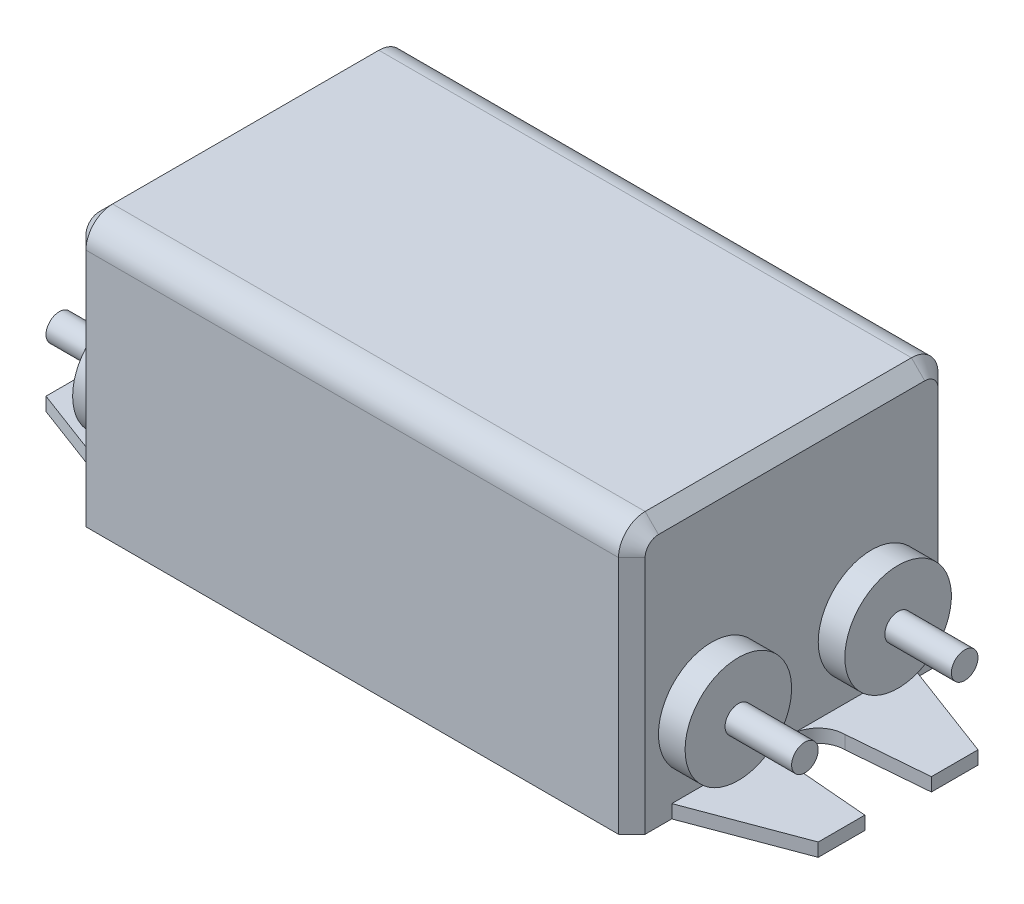
from build123d import *

# Parameters (mm, degrees)
SKETCH_1_W               = 40
SKETCH_1_H               = 24
EXTRUDE_1_DEPTH          = 20
EXTRUDE_2_DEPTH          = 1
EXTRUDE_2_2_DEPTH        = 1
EXTRUDE_2_3_DEPTH        = 1
EXTRUDE_2_4_DEPTH        = 1
SKETCH_1_6_W             = 1
SKETCH_1_6_H             = 24
EXTRUDE_4_DEPTH          = 20
SKETCH_2_R               = 4
EXTRUDE_5_DEPTH          = 2
FILLET_1_R               = 2
CHAMFER_1_SIZE           = 1
CHAMFER_2_SIZE           = 1
SKETCH_3_R               = 1
EXTRUDE_6_DEPTH          = 5
MIRROR_4_COPY_1_SKETCH_R = 1
MIRROR_4_COPY_1_DEPTH    = 5
MIRROR_4_COPY_2_SKETCH_R = 1
MIRROR_4_COPY_2_DEPTH    = 5


with BuildPart() as part:
    # 草图1 → 凸台-拉伸1 (new body)
    with BuildSketch(Plane(origin=(0, 0, 0), x_dir=(1, 0, 0), z_dir=(0, 1, 0))):
        Rectangle(SKETCH_1_W, SKETCH_1_H)
    extrude(amount=EXTRUDE_1_DEPTH)



with BuildPart() as body_2:
    # 草图1<4> → 凸台-拉伸2 (new body)
    with BuildSketch(Plane(origin=(0, 0, 0), x_dir=(1, 0, 0), z_dir=(0, 1, 0))):
        with BuildLine():
            Line((-21, 0), (-21, 9))
            Line((-21, 9), (-29, 6))
            Line((-29, 6), (-29, 2.5))
            Line((-29, 2.5), (-23, 2))
            ThreePointArc((-23, 2), (-21.585786438, 1.414213562), (-21, 0))
        make_face()
    extrude(amount=EXTRUDE_2_DEPTH)


with BuildPart() as body_3:
    # 草图1<4> → Extrude 2 2 (new body)
    with BuildSketch(Plane(origin=(0, 0, 0), x_dir=(1, 0, 0), z_dir=(0, 1, 0))):
        with BuildLine():
            Line((29, 6), (21, 9))
            Line((21, 9), (21, 0))
            ThreePointArc((21, 0), (21.585786438, 1.414213562), (23, 2))
            Line((23, 2), (29, 2.5))
            Line((29, 2.5), (29, 6))
        make_face()
    extrude(amount=EXTRUDE_2_2_DEPTH)


with BuildPart() as body_4:
    # 草图1<4> → Extrude 2 3 (new body)
    with BuildSketch(Plane(origin=(0, 0, 0), x_dir=(1, 0, 0), z_dir=(0, 1, 0))):
        with BuildLine():
            Line((-29, -6), (-21, -9))
            Line((-21, -9), (-21, 0))
            ThreePointArc((-21, 0), (-21.585786438, -1.414213562), (-23, -2))
            Line((-23, -2), (-29, -2.5))
            Line((-29, -2.5), (-29, -6))
        make_face()
    extrude(amount=EXTRUDE_2_3_DEPTH)


with BuildPart() as body_5:
    # 草图1<4> → Extrude 2 4 (new body)
    with BuildSketch(Plane(origin=(0, 0, 0), x_dir=(1, 0, 0), z_dir=(0, 1, 0))):
        with BuildLine():
            Line((21, 0), (21, -9))
            Line((21, -9), (29, -6))
            Line((29, -6), (29, -2.5))
            Line((29, -2.5), (23, -2))
            ThreePointArc((23, -2), (21.585786438, -1.414213562), (21, 0))
        make_face()
    extrude(amount=EXTRUDE_2_4_DEPTH)


with BuildPart() as part_1:
    add(part.part)

    add(body_2.part)  # 凸台-拉伸4 merges body 2

    add(body_3.part)  # 凸台-拉伸4 merges body 3

    add(body_4.part)  # 凸台-拉伸4 merges body 4

    add(body_5.part)  # 凸台-拉伸4 merges body 5
    # 草图1<6> → 凸台-拉伸4 (add)
    with BuildSketch(Plane(origin=(0, 0, 0), x_dir=(1, 0, 0), z_dir=(0, 1, 0))):
        with Locations((-20.5, 0)):
            Rectangle(SKETCH_1_6_W, SKETCH_1_6_H)
        with Locations((20.5, 0)):
            Rectangle(SKETCH_1_6_W, SKETCH_1_6_H)
    extrude(amount=EXTRUDE_4_DEPTH)

    # 草图2 → 凸台-拉伸5 (add)
    with BuildSketch(Plane.ZY.offset(21)):
        with Locations((6, 6)):
            Circle(SKETCH_2_R)
        with Locations((-6, 6)):
            Circle(SKETCH_2_R)
    extrude_5 = extrude(amount=EXTRUDE_5_DEPTH)

    # 镜向1: 凸台-拉伸5 across plane
    add(extrude_5.mirror(Plane(origin=(0, 0, 0), x_dir=(0, 0, 1), z_dir=(1, 0, 0))))

    # 圆角1
    fillet_1_edges = [part_1.edges().sort_by_distance(p)[0] for p in [
        (0, 20, -12),
        (0, 20, 12),
    ]]
    fillet(fillet_1_edges, radius=FILLET_1_R)

    # 倒角1
    chamfer_1_edges = [part_1.edges().sort_by_distance(p)[0] for p in [
        (21, 9, -12),
        (21, 9, 12),
        (21, 19.414213562, -11.414213562),
        (21, 19.414213562, 11.414213562),
        (21, 20, 0),
    ]]
    chamfer(chamfer_1_edges, length=CHAMFER_1_SIZE)

    # 倒角2
    chamfer_2_edges = [part_1.edges().sort_by_distance(p)[0] for p in [
        (-21, 9, -12),
        (-21, 9, 12),
        (-21, 19.414213562, -11.414213562),
        (-21, 19.414213562, 11.414213562),
        (-21, 20, 0),
    ]]
    chamfer(chamfer_2_edges, length=CHAMFER_2_SIZE)

    # 草图3 → 凸台-拉伸6 (add)
    with BuildSketch(Plane.ZY.offset(23)):
        with Locations((6, 6)):
            Circle(SKETCH_3_R)
    extrude_6 = extrude(amount=EXTRUDE_6_DEPTH)

    # 镜向2: 凸台-拉伸6 across plane
    add(extrude_6.mirror(Plane.XY))

    # 镜向3: 凸台-拉伸6 across plane
    add(extrude_6.mirror(Plane(origin=(0, 0, 0), x_dir=(0, 0, 1), z_dir=(1, 0, 0))))

    # 镜向4 copy 1 sketch → 镜向4 copy 1 (add)
    with BuildSketch(Plane(origin=(23, 0, 0), x_dir=(0, 0, -1), z_dir=(1, 0, 0))):
        with Locations((6, 6)):
            Circle(MIRROR_4_COPY_1_SKETCH_R)
    extrude(amount=MIRROR_4_COPY_1_DEPTH)

    # 镜向4 copy 2 sketch → 镜向4 copy 2 (add)
    with BuildSketch(Plane(origin=(23, 0, 0), x_dir=(0, 0, 1), z_dir=(1, 0, 0))):
        with Locations((6, -6)):
            Circle(MIRROR_4_COPY_2_SKETCH_R)
    extrude(amount=MIRROR_4_COPY_2_DEPTH)


solid = part_1.part
